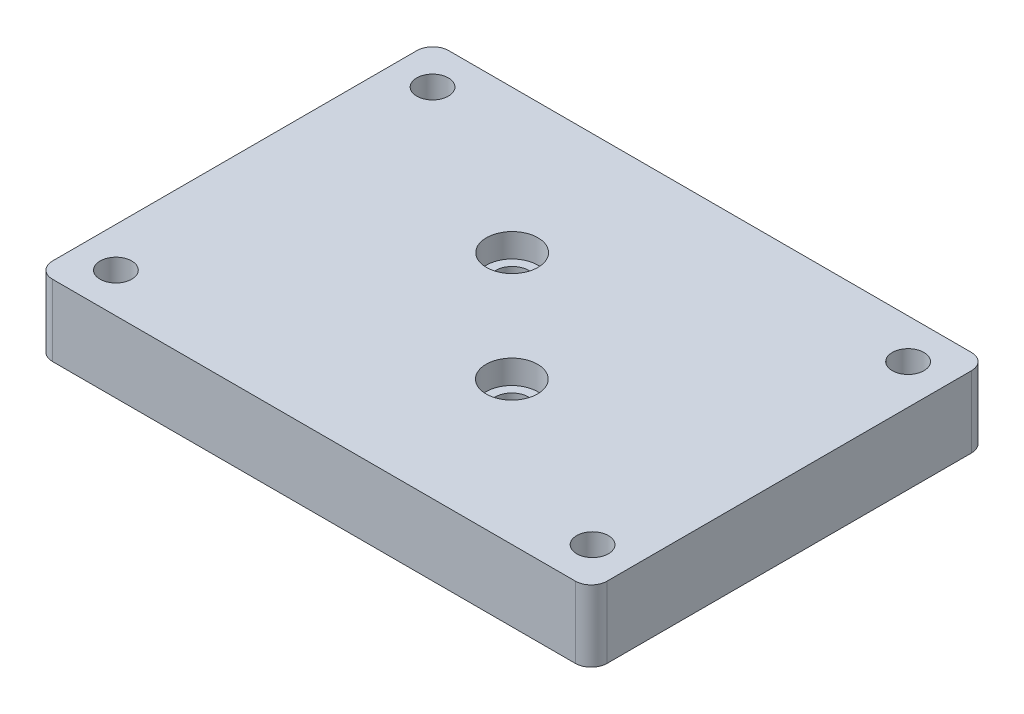
from build123d import *

# Parameters (mm, degrees)
SKETCH1_W           = 70
SKETCH1_H           = 50
SKETCH1_R           = 2
SKETCH1_R_2         = 6.5
BOSS_EXTRUDE1_DEPTH = 9
SKETCH5_R           = 2.1
CUT_EXTRUDE1_DEPTH  = 9
SKETCH6_R           = 3.25
CUT_EXTRUDE2_DEPTH  = 3
FILLET1_R           = 2
BOSS_EXTRUDE3_START = -4.5
SKETCH8_R           = 6.5
BOSS_EXTRUDE3_DEPTH = 4.5


with BuildPart() as part:
    # Sketch1 → Boss-Extrude1 (new body)
    with BuildSketch(Plane(origin=(0, 0, 0), x_dir=(1, 0, 0), z_dir=(0, 1, 0))):
        with Locations((-28.500824125, 0.1029652)):
            Rectangle(SKETCH1_W, SKETCH1_H)
        with Locations(Location((-58.528775182, 20.1029652, 0), (0, 0, 270))):
            Circle(SKETCH1_R, mode=Mode.SUBTRACT)
        with Locations(Location((-58.500824125, -19.8970348, 0), (0, 0, 270))):
            Circle(SKETCH1_R, mode=Mode.SUBTRACT)
        with Locations(Location((1.600142136, -19.83023128, 0), (0, 0, 270))):
            Circle(SKETCH1_R, mode=Mode.SUBTRACT)
        with Locations(Location((1.499175875, 20.1029652, 0), (0, 0, 270))):
            Circle(SKETCH1_R, mode=Mode.SUBTRACT)
        with Locations(Location((-28.500824125, 0.1029652, 0), (0, 0, 270))):
            Circle(SKETCH1_R_2, mode=Mode.SUBTRACT)
    extrude(amount=BOSS_EXTRUDE1_DEPTH)

    # Sketch5 → Cut-Extrude1 (cut)
    with BuildSketch(Plane(origin=(0, 9, 0), x_dir=(1, 0, 0), z_dir=(0, 1, 0))):
        with Locations(Location((-35.4063316, 7.028451935, 0), (0, 0, 270))):
            Circle(SKETCH5_R)
        with Locations(Location((-21.595316651, -6.822521536, 0), (0, 0, 270))):
            Circle(SKETCH5_R)
    extrude(amount=-CUT_EXTRUDE1_DEPTH, mode=Mode.SUBTRACT)

    # Sketch6 → Cut-Extrude2 (cut)
    with BuildSketch(Plane(origin=(0, 9, 0), x_dir=(1, 0, 0), z_dir=(0, 1, 0))):
        with Locations(Location((-35.4063316, 7.028451935, 0), (0, 0, 270))):
            Circle(SKETCH6_R)
        with Locations(Location((-21.595316651, -6.822521536, 0), (0, 0, 270))):
            Circle(SKETCH6_R)
    extrude(amount=-CUT_EXTRUDE2_DEPTH, mode=Mode.SUBTRACT)

    # Fillet1
    fillet1_edges = [part.edges().sort_by_distance(p)[0] for p in [
        (6.499175875, 4.5, -25.1029652),
        (6.499175875, 4.5, 24.8970348),
        (-63.500824125, 4.5, 24.8970348),
        (-63.500824125, 4.5, -25.1029652),
    ]]
    fillet(fillet1_edges, radius=FILLET1_R)

    # Sketch8 → Boss-Extrude3 (add)
    with BuildSketch(Plane(origin=(0, 9, 0), x_dir=(1, 0, 0), z_dir=(0, 1, 0)).offset(BOSS_EXTRUDE3_START)):
        with Locations(Location((-28.500824125, 0.1029652, 0), (0, 0, 270))):
            Circle(SKETCH8_R)
    extrude(amount=BOSS_EXTRUDE3_DEPTH)


solid = part.part
